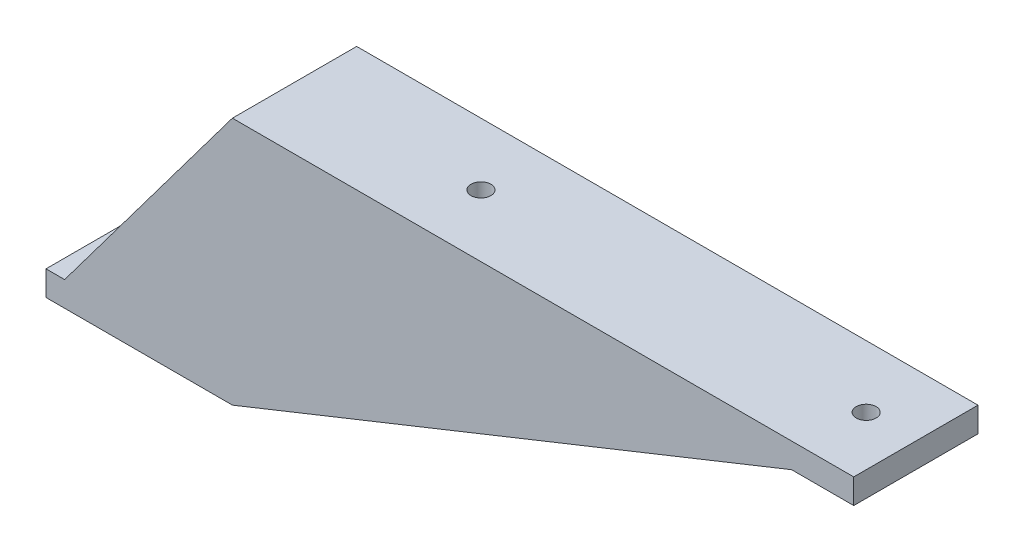
from build123d import *

# Parameters (mm, degrees)
BOSS_EXTRUDE1_DEPTH = 2
SKETCH2_W           = 50
SKETCH2_H           = 10
BOSS_EXTRUDE2_DEPTH = 2
SKETCH3_W           = 15
SKETCH3_H           = 10
BOSS_EXTRUDE3_DEPTH = 2
BOSS_EXTRUDE4_DEPTH = 2
BOSS_EXTRUDE5_DEPTH = 6
SKETCH7_R           = 0.8
CUT_EXTRUDE1_DEPTH  = 20


with BuildPart() as part:
    # Sketch1 → Boss-Extrude1 (new body)
    with BuildSketch(Plane.XY):
        Polygon((0, 0), (-15, 0), (0, 20), (50, 20), align=None)
    extrude(amount=BOSS_EXTRUDE1_DEPTH)

    # Sketch2 → Boss-Extrude2 (add)
    with BuildSketch(Plane(origin=(0, 20, 0), x_dir=(1, 0, 0), z_dir=(0, 1, 0))):
        with Locations((25, 3)):
            Rectangle(SKETCH2_W, SKETCH2_H)
    extrude(amount=-BOSS_EXTRUDE2_DEPTH)

    # Sketch3 → Boss-Extrude3 (add)
    with BuildSketch(Plane.XZ):
        with Locations((-7.5, -3)):
            Rectangle(SKETCH3_W, SKETCH3_H)
    extrude(amount=-BOSS_EXTRUDE3_DEPTH)

    # Sketch4 → Boss-Extrude4 (add)
    with BuildSketch(Plane(origin=(0, 0, -8), x_dir=(-1, 0, 0), z_dir=(0, 0, -1))):
        Polygon((-50, 20), (0, 0), (15, 0), (0, 20), align=None)
    extrude(amount=-BOSS_EXTRUDE4_DEPTH)

    # Sketch6 → Boss-Extrude5 (add)
    with BuildSketch(Plane(origin=(0, 0, 0), x_dir=(-1, 0, 0), z_dir=(0, 0, -1))):
        Polygon((0, 20), (0, 18), (-1, 18), (-1, 0.4), (0, 0), (0, 2), (1, 2), (1, 18.666666667), align=None)
    extrude(amount=BOSS_EXTRUDE5_DEPTH)

    # Sketch7 → Cut-Extrude1 (cut)
    with BuildSketch(Plane(origin=(0, 20, 0), x_dir=(1, 0, 0), z_dir=(0, 1, 0))):
        with Locations((46, 3)):
            Circle(SKETCH7_R)
        with Locations((15, 3)):
            Circle(SKETCH7_R)
        with Locations((-11, 3)):
            Circle(SKETCH7_R)
        with Locations((-5, 3)):
            Circle(SKETCH7_R)
    extrude(amount=-CUT_EXTRUDE1_DEPTH, mode=Mode.SUBTRACT)


solid = part.part
